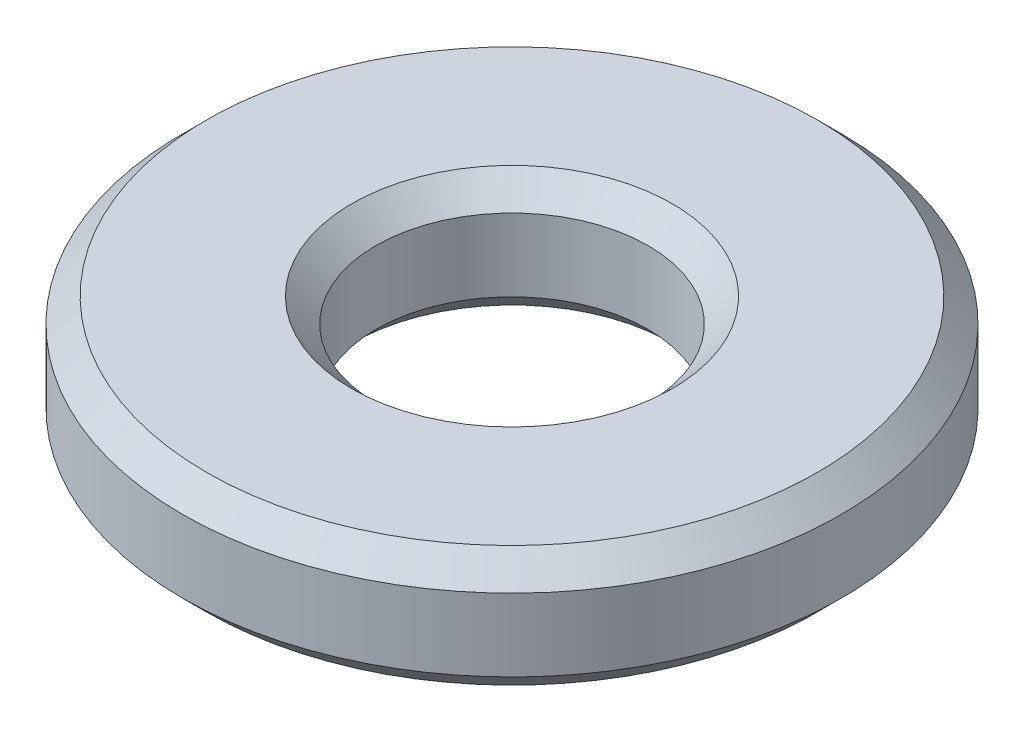
from build123d import *

# Parameters (mm, degrees)
SKETCH2_R           = 5.45
SKETCH2_R_2         = 2.25
BOSS_EXTRUDE1_DEPTH = 2
CHAMFER1_SIZE       = 0.4


with BuildPart() as part:
    # Sketch2 → Boss-Extrude1 (new body)
    with BuildSketch(Plane(origin=(0, 0, 0), x_dir=(1, 0, 0), z_dir=(0, 1, 0))):
        with Locations(Location((0, 0, 0), (0, 0, 270))):
            Circle(SKETCH2_R)
        with Locations(Location((0, 0, 0), (0, 0, 270))):
            Circle(SKETCH2_R_2, mode=Mode.SUBTRACT)
    extrude(amount=BOSS_EXTRUDE1_DEPTH)

    # Chamfer1
    chamfer1_edges = [part.edges().sort_by_distance(p)[0] for p in [
        (0, 0, -5.45),
        (0, 2, -5.45),
        (0, 0, -2.25),
        (0, 2, -2.25),
    ]]
    chamfer(chamfer1_edges, length=CHAMFER1_SIZE)


solid = part.part
